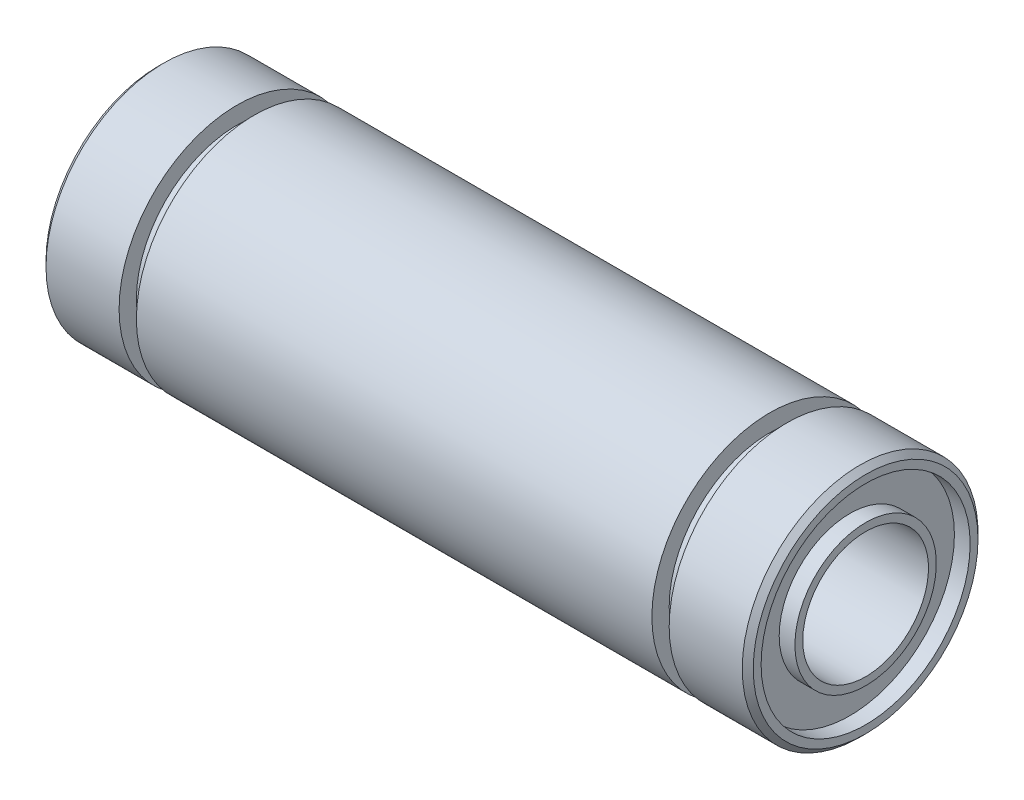
from build123d import *


with BuildPart() as part:
    # Sketch1 → Revolve1 (revolve)
    with BuildSketch(Plane.XY, mode=Mode.PRIVATE) as revolve1_sk:
        Polygon((22.15, 7.5), (22.5, 7.15), (22.5, 6.65), (21.5, 6.65), (21.5, 4.5), (22.5, 4.5), (22.5, 4), (-22.5, 4), (-22.5, 4.5), (-21.5, 4.5), (-21.5, 6.65), (-22.5, 6.65), (-22.5, 7.15), (-22.15, 7.5), (-17.5, 7.5), (-17.5, 6.4), (-16.4, 6.4), (-16.4, 7.5), (16.4, 7.5), (16.4, 6.4), (17.5, 6.4), (17.5, 7.5), align=None)
    revolve(revolve1_sk.sketch.rotate(Axis((-45.689505325, 0, 0), (1, 0, 0)), 90), axis=Axis((-45.689505325, 0, 0), (1, 0, 0)))


solid = part.part
